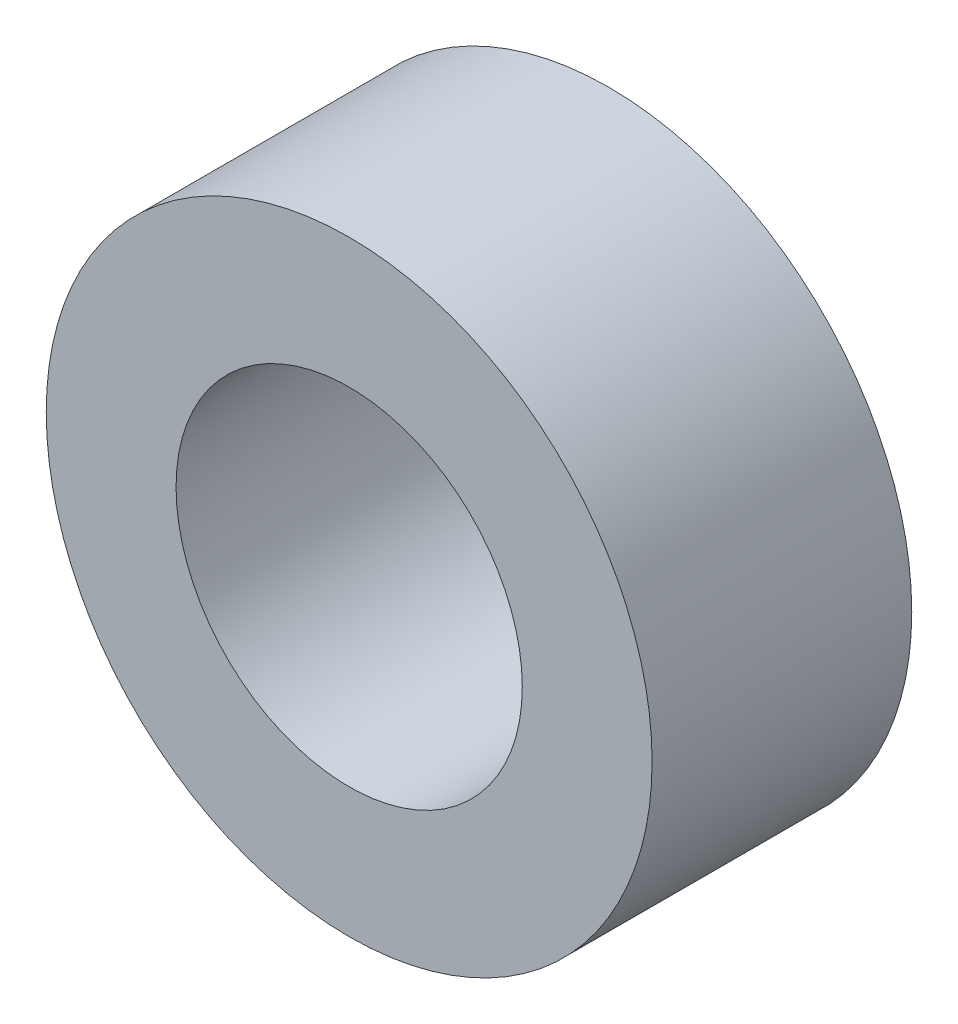
from build123d import *

# Parameters (mm, degrees)
SKETCH1_R           = 3.5
SKETCH1_R_2         = 2
BOSS_EXTRUDE1_DEPTH = 3


with BuildPart() as part:
    # Sketch1 → Boss-Extrude1 (new body)
    with BuildSketch(Plane.XY):
        Circle(SKETCH1_R)
        Circle(SKETCH1_R_2, mode=Mode.SUBTRACT)
    extrude(amount=BOSS_EXTRUDE1_DEPTH)


solid = part.part
